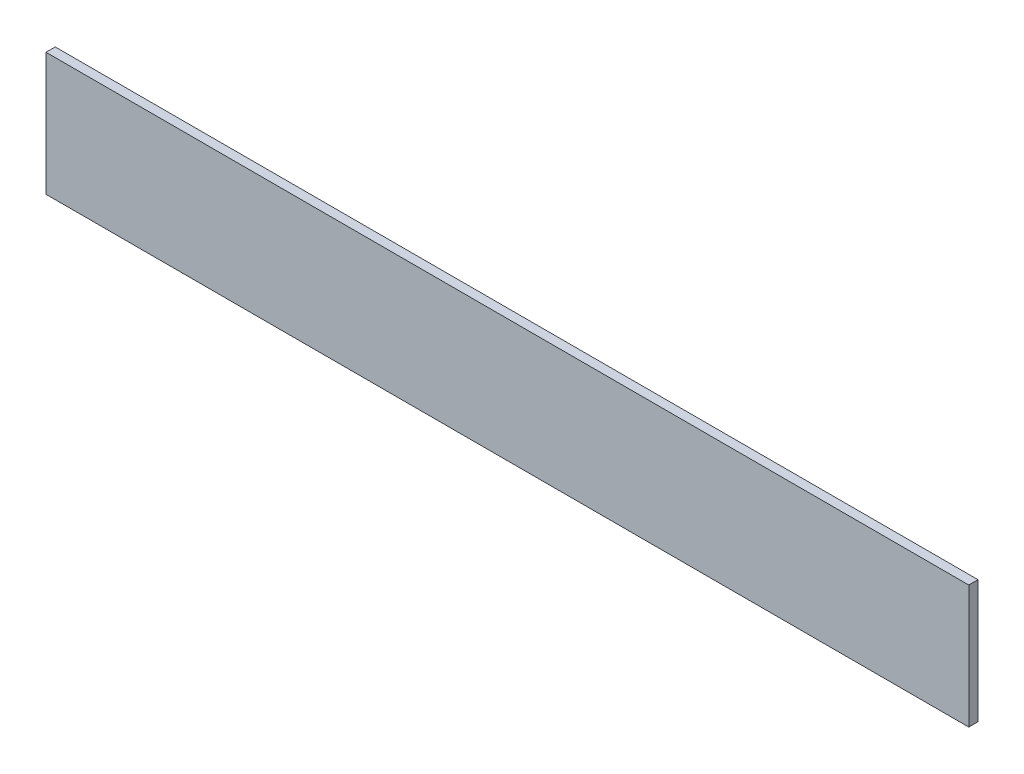
from build123d import *

# Parameters (mm, degrees)
SKETCH1_W           = 300
SKETCH1_H           = 40
BOSS_EXTRUDE1_DEPTH = 3


with BuildPart() as part:
    # Sketch1 → Boss-Extrude1 (new body)
    with BuildSketch(Plane.XY):
        with Locations((150, 20)):
            Rectangle(SKETCH1_W, SKETCH1_H)
    extrude(amount=BOSS_EXTRUDE1_DEPTH)


solid = part.part
